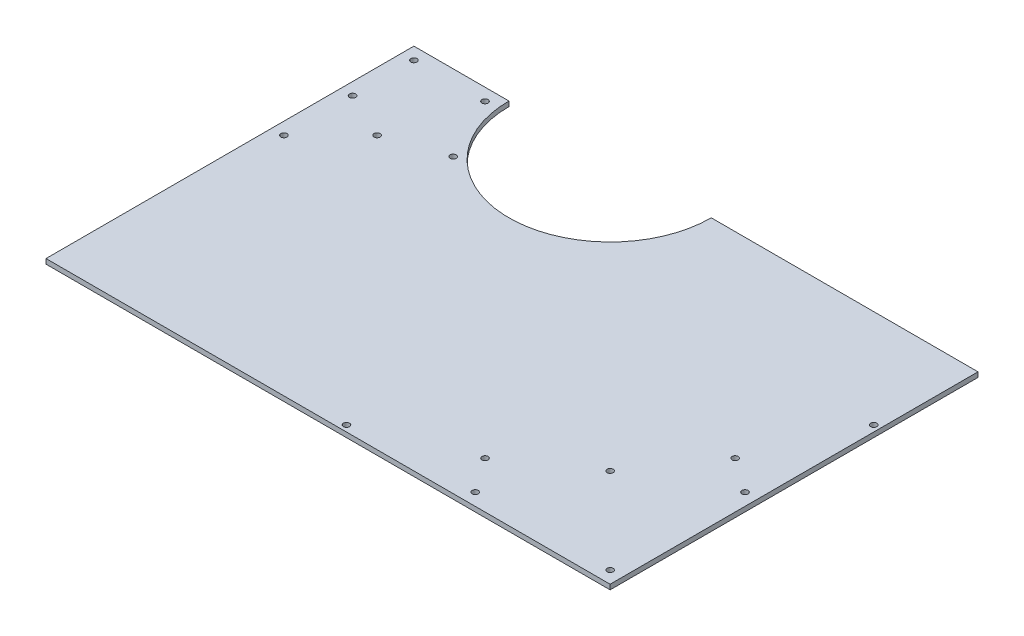
from build123d import *

# Parameters (mm, degrees)
BOSS_EXTRUDE1_DEPTH = 5.08
SKETCH4_R           = 104.775
CUT_EXTRUDE1_DEPTH  = 50.8
SKETCH5_R           = 3.175
CUT_EXTRUDE2_DEPTH  = 5.08
SKETCH6_R           = 3.175
CUT_EXTRUDE3_DEPTH  = 5.08


with BuildPart() as part:
    # Sketch2 → Boss-Extrude1 (new body)
    with BuildSketch(Plane(origin=(0, 0, 0), x_dir=(1, 0, 0), z_dir=(0, 1, 0))):
        Polygon((-203.2, 381), (-44.423028516, 381), (-44.423028516, 423.747508854), (44.020558762, 423.747508854), (44.020558762, 381), (381, 381), (381, 0), (-203.2, 0), align=None)
    extrude(amount=BOSS_EXTRUDE1_DEPTH)

    # Sketch4 → Cut-Extrude1 (cut)
    with BuildSketch(Plane.XZ):
        with Locations((0, -381)):
            Circle(SKETCH4_R)
    extrude(amount=-CUT_EXTRUDE1_DEPTH, mode=Mode.SUBTRACT)

    # Sketch5 → Cut-Extrude2 (cut)
    with BuildSketch(Plane(origin=(0, 5.08, 0), x_dir=(1, 0, 0), z_dir=(0, 1, 0))):
        with Locations(Location((332.74, 177.8, 0), (0, 0, 270))):
            Circle(SKETCH5_R)
        with Locations(Location((101.6, 6.35, 0), (0, 0, 270))):
            Circle(SKETCH5_R)
        with Locations(Location((203.2, 48.26, 0), (0, 0, 270))):
            Circle(SKETCH5_R)
        with Locations(Location((279.4, 101.6, 0), (0, 0, 270))):
            Circle(SKETCH5_R)
        with Locations(Location((368.3, 152.4, 0), (0, 0, 270))):
            Circle(SKETCH5_R)
        with Locations(Location((374.65, 279.4, 0), (0, 0, 270))):
            Circle(SKETCH5_R)
        with Locations(Location((368.3, 12.7, 0), (0, 0, 270))):
            Circle(SKETCH5_R)
        with Locations(Location((228.6, 12.7, 0), (0, 0, 270))):
            Circle(SKETCH5_R)
    extrude(amount=-CUT_EXTRUDE2_DEPTH, mode=Mode.SUBTRACT)

    # Sketch6 → Cut-Extrude3 (cut)
    with BuildSketch(Plane(origin=(0, 5.08, 0), x_dir=(1, 0, 0), z_dir=(0, 1, 0))):
        with Locations(Location((-190.5, 368.3, 0), (0, 0, 270))):
            Circle(SKETCH6_R)
        with Locations(Location((-116.84, 368.3, 0), (0, 0, 270))):
            Circle(SKETCH6_R)
        with Locations(Location((-83.82, 302.26, 0), (0, 0, 270))):
            Circle(SKETCH6_R)
        with Locations(Location((-142.24, 281.94, 0), (0, 0, 270))):
            Circle(SKETCH6_R)
        with Locations(Location((-190.5, 233.68, 0), (0, 0, 270))):
            Circle(SKETCH6_R)
        with Locations(Location((-190.5, 304.8, 0), (0, 0, 270))):
            Circle(SKETCH6_R)
    extrude(amount=-CUT_EXTRUDE3_DEPTH, mode=Mode.SUBTRACT)


solid = part.part
